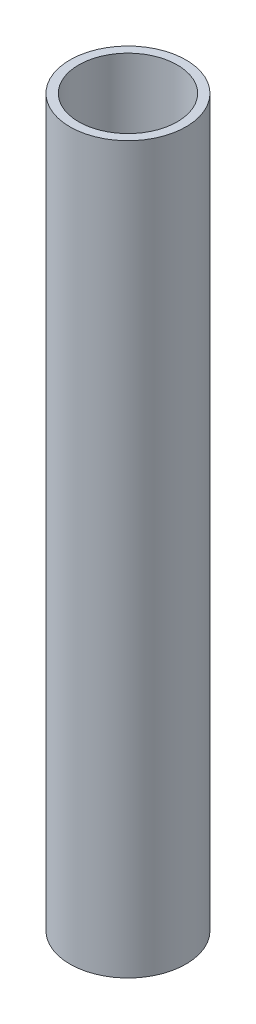
from build123d import *

# Parameters (mm, degrees)
SKETCH_1_R      = 16
SKETCH_1_R_2    = 13.6
EXTRUDE_1_DEPTH = 200


with BuildPart() as part:
    # 草图1 → 凸台-拉伸1 (new body)
    with BuildSketch(Plane(origin=(0, 0, 0), x_dir=(1, 0, 0), z_dir=(0, 1, 0))):
        with Locations(Location((0, 0, 0), (0, 0, 270))):
            Circle(SKETCH_1_R)
        with Locations(Location((0, 0, 0), (0, 0, 270))):
            Circle(SKETCH_1_R_2, mode=Mode.SUBTRACT)
    extrude(amount=EXTRUDE_1_DEPTH)


solid = part.part
